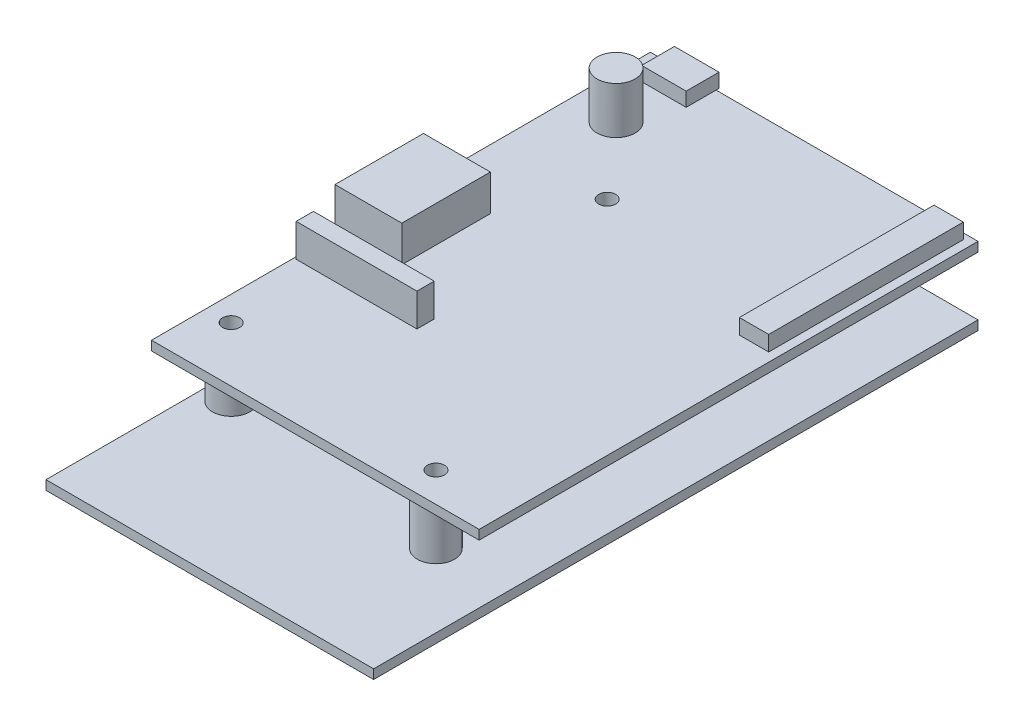
from build123d import *

# Parameters (mm, degrees)
SKETCH2_W               = 55.88
SKETCH2_H               = 85.09
FIBERGLASS_PCB_DEPTH    = 1.6
SKETCH3_W               = 7.6
SKETCH3_H               = 5.6
USB_MICRO_B_POWER_DEPTH = 2.4
SKETCH4_W               = 5
SKETCH4_H               = 33.2
BOSS_EXTRUDE3_DEPTH     = 2.6
SKETCH5_W               = 11.4
SKETCH5_H               = 15.1
BOSS_EXTRUDE4_DEPTH     = 6.15
SKETCH6_W               = 20.6
SKETCH6_H               = 2.95
BOSS_EXTRUDE5_DEPTH     = 5.6
SKETCH8_R               = 3.25
BOSS_EXTRUDE6_DEPTH     = 8
SKETCH9_W               = 28.4
SKETCH9_H               = 16.8
BOSS_EXTRUDE7_DEPTH     = 3.9
SKETCH10_W              = 24
SKETCH10_H              = 2.1
BOSS_EXTRUDE8_DEPTH     = 2.286
SKETCH11_R              = 1.45
CUT_EXTRUDE1_DEPTH      = 54.073569326
SKETCH12_R              = 3.175
BOSS_EXTRUDE9_DEPTH     = 10
SKETCH13_W              = 55.88
SKETCH13_H              = 103.09
BOSS_EXTRUDE10_DEPTH    = 1.5875
SKETCH14_R              = 1.45
CUT_EXTRUDE2_DEPTH      = 69.474424286
CUT_EXTRUDE3_DEPTH      = 0.75
SKETCH16_W              = 14.0335
SKETCH16_H              = 17.145
BOSS_EXTRUDE11_DEPTH    = 1.9685
BOSS_EXTRUDE13_REACH    = 70.474
SKETCH18_R              = 3.175
SKETCH19_R              = 1.45
CUT_EXTRUDE5_DEPTH      = 69.474424286


with BuildPart() as part:
    # Sketch2 → Fiberglass PCB (new body)
    with BuildSketch(Plane(origin=(0, 0, 0), x_dir=(1, 0, 0), z_dir=(0, 1, 0))):
        Rectangle(SKETCH2_W, SKETCH2_H)
    extrude(amount=FIBERGLASS_PCB_DEPTH)

    # Sketch3 → USB Micro-B Power (add)
    with BuildSketch(Plane(origin=(0, 1.6, 0), x_dir=(1, 0, 0), z_dir=(0, 1, 0))):
        with Locations((-20.54, 40.245)):
            Rectangle(SKETCH3_W, SKETCH3_H)
    extrude(amount=USB_MICRO_B_POWER_DEPTH)

    # Sketch4 → Boss-Extrude3 (add)
    with BuildSketch(Plane(origin=(0, 1.6, 0), x_dir=(1, 0, 0), z_dir=(0, 1, 0))):
        with Locations((23.94, 24.945)):
            Rectangle(SKETCH4_W, SKETCH4_H)
    extrude(amount=BOSS_EXTRUDE3_DEPTH)

    # Sketch5 → Boss-Extrude4 (add)
    with BuildSketch(Plane(origin=(0, 1.6, 0), x_dir=(1, 0, 0), z_dir=(0, 1, 0))):
        with Locations((-23.44, -2.505)):
            Rectangle(SKETCH5_W, SKETCH5_H)
    extrude(amount=BOSS_EXTRUDE4_DEPTH)

    # Sketch6 → Boss-Extrude5 (add)
    with BuildSketch(Plane(origin=(0, 1.6, 0), x_dir=(1, 0, 0), z_dir=(0, 1, 0))):
        with Locations((-17.26, -16.78)):
            Rectangle(SKETCH6_W, SKETCH6_H)
    extrude(amount=BOSS_EXTRUDE5_DEPTH)

    # Sketch8 → Boss-Extrude6 (add)
    with BuildSketch(Plane(origin=(0, 1.6, 0), x_dir=(1, 0, 0), z_dir=(0, 1, 0))):
        with Locations(Location((-20.54, 29.295, 0), (0, 0, 90))):
            Circle(SKETCH8_R)
    extrude(amount=BOSS_EXTRUDE6_DEPTH)

    # Sketch9 → Boss-Extrude7 (add)
    with BuildSketch(Plane.XZ):
        with Locations((1.26, -32.945)):
            Rectangle(SKETCH9_W, SKETCH9_H)
    extrude(amount=BOSS_EXTRUDE7_DEPTH)

    # Sketch10 → Boss-Extrude8 (add)
    with BuildSketch(Plane(origin=(0, 0, -41.345), x_dir=(-1, 0, 0), z_dir=(0, 0, -1))):
        with Locations((-2.097, -2.1)):
            Rectangle(SKETCH10_W, SKETCH10_H)
    extrude(amount=BOSS_EXTRUDE8_DEPTH)

    # Sketch11 → Cut-Extrude1 (cut, through all)
    with BuildSketch(Plane(origin=(0, 1.6, 0), x_dir=(1, 0, 0), z_dir=(0, 1, 0))):
        with Locations(Location((15.494, -37.465, 0), (0, 0, 270))):
            Circle(SKETCH11_R)
        with Locations(Location((-9.906, 17.145, 0), (0, 0, 270))):
            Circle(SKETCH11_R)
    extrude(amount=-CUT_EXTRUDE1_DEPTH, mode=Mode.SUBTRACT)

    # Sketch12 → Boss-Extrude9 (add)
    with BuildSketch(Plane.XZ):
        with Locations(Location((-9.906, -17.145, 0), (0, 0, 270))):
            Circle(SKETCH12_R)
        with Locations(Location((15.494, 37.465, 0), (0, 0, 270))):
            Circle(SKETCH12_R)
    extrude(amount=BOSS_EXTRUDE9_DEPTH)

    # Sketch13 → Boss-Extrude10 (add)
    with BuildSketch(Plane.XZ.offset(10)):
        with Locations((0, 9)):
            Rectangle(SKETCH13_W, SKETCH13_H)
    extrude(amount=BOSS_EXTRUDE10_DEPTH)

    # Sketch14 → Cut-Extrude2 (cut, through all)
    with BuildSketch(Plane(origin=(0, 1.6, 0), x_dir=(1, 0, 0), z_dir=(0, 1, 0))):
        with Locations(Location((-9.906, 17.145, 0), (0, 0, 270))):
            Circle(SKETCH14_R)
        with Locations(Location((15.494, -37.465, 0), (0, 0, 270))):
            Circle(SKETCH14_R)
    extrude(amount=-CUT_EXTRUDE2_DEPTH, mode=Mode.SUBTRACT)

    # Sketch15 → Cut-Extrude3 (cut)
    with BuildSketch(Plane(origin=(0, -3.9, 0), x_dir=(-1, 0, 0), z_dir=(0, -1, 0))):
        Polygon((8.7335, 41.345), (-12.412, 41.345), (-12.412, 30.12806403), (-10.16693597, 27.883), (8.7335, 27.883), align=None)
    extrude(amount=-CUT_EXTRUDE3_DEPTH, mode=Mode.SUBTRACT)

    # Sketch16 → Boss-Extrude11 (add)
    with BuildSketch(Plane.XZ.offset(3.15)):
        with Locations((1.80115, -37.4715)):
            Rectangle(SKETCH16_W, SKETCH16_H)
    extrude(amount=BOSS_EXTRUDE11_DEPTH)

    # Sketch18 → Boss-Extrude13 (add, up to next)
    with BuildSketch(Plane(origin=(0, 1.6, 0), x_dir=(1, 0, 0), z_dir=(0, 1, 0)), mode=Mode.PRIVATE) as boss_extrude13_sk1:
        with Locations(Location((-23.749, -33.1597, 0), (0, 0, 270))):
            Circle(SKETCH18_R)
    boss_extrude13_tool1 = extrude(boss_extrude13_sk1.sketch, amount=-BOSS_EXTRUDE13_REACH, mode=Mode.PRIVATE) - part.part
    add(boss_extrude13_tool1.solids().sort_by_distance((-23.749, 1.6, 33.1597))[0])

    # Sketch19 → Cut-Extrude5 (cut, through all)
    with BuildSketch(Plane(origin=(0, 1.6, 0), x_dir=(1, 0, 0), z_dir=(0, 1, 0))):
        with Locations(Location((-23.749, -33.1597, 0), (0, 0, 270))):
            Circle(SKETCH19_R)
    extrude(amount=-CUT_EXTRUDE5_DEPTH, mode=Mode.SUBTRACT)


solid = part.part
